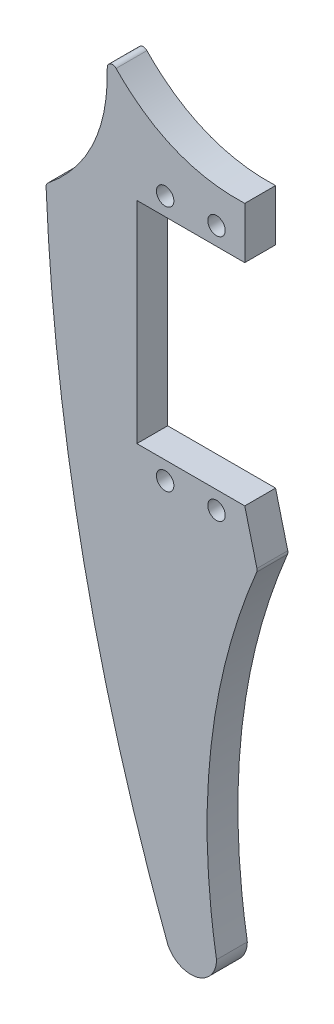
from build123d import *

# Parameters (mm, degrees)
SKETCH1_R           = 1.7
BOSS_EXTRUDE1_DEPTH = 6
FILLET1_R           = 1


with BuildPart() as part:
    # Sketch1 → Boss-Extrude1 (new body)
    # profile 1 of 2: a face of its own
    with BuildSketch(Plane.XY):
        with BuildLine():
            Line((10.5, -20.5), (-10.5, -20.5))
            Line((-10.5, -20.5), (-10.5, 20.5))
            Line((-10.5, 20.5), (10.5, 20.5))
            Line((10.5, 20.5), (10.5, 30.5))
            add(Edge.make_bspline(
                [(10.5, 30.5), (-5.463373434, 29.901564355), (-16.430762864, 42.802630452)],
                knots=[0, 0, 0, 1, 1, 1], degree=2))
            add(Edge.make_bspline(
                [(-16.430762864, 42.802630452), (-14.784114241, 25.00850842), (-28.192589157, 14.474851635)],
                knots=[0, 0, 0, 1, 1, 1], degree=2))
            add(Edge.make_bspline(
                [(-28.192589157, 14.474851635), (-25.736030858, -44.983019262), (-4.860661097, -100.922166241)],
                knots=[0, 0, 0, 0.989904815, 0.989904815, 0.989904815], degree=2))
            ThreePointArc((-4.860661097, -100.922166241), (-1.370198617, -94.941408132), (4.748458048, -98.184066997))
            add(Edge.make_bspline(
                [(12.954080919, -30.194198618), (-0.768915938, -62.557526438), (4.748458048, -98.184066997)],
                knots=[0, 0, 0, 0.978516684, 0.978516684, 0.978516684], degree=2))
            Line((12.954080919, -30.194198618), (10.5, -20.5))
        make_face()
        with Locations((-5, -24)):
            Circle(SKETCH1_R, mode=Mode.SUBTRACT)
        with Locations((5, -24)):
            Circle(SKETCH1_R, mode=Mode.SUBTRACT)
        with Locations((-5, 24)):
            Circle(SKETCH1_R, mode=Mode.SUBTRACT)
        with Locations((5, 24)):
            Circle(SKETCH1_R, mode=Mode.SUBTRACT)
    # profile 2 of 2: a face of its own
    with BuildSketch(Plane.XY):
        with BuildLine():
            add(Edge.make_bspline(
                [(4.748458048, -98.184066997), (4.86959189, -98.96624703), (5, -99.75)],
                knots=[0.978516684, 0.978516684, 0.978516684, 1, 1, 1], degree=2))
            ThreePointArc((4.748458048, -98.184066997), (-1.370198617, -94.941408132), (-4.860661097, -100.922166241))
            add(Edge.make_bspline(
                [(-4.860661097, -100.922166241), (-4.647771209, -101.492641346), (-4.432965727, -102.062750497)],
                knots=[0.989904815, 0.989904815, 0.989904815, 1, 1, 1], degree=2))
            ThreePointArc((-4.432965727, -102.062750497), (1.190624073, -104.606172806), (5, -99.75))
        make_face()
    extrude(amount=BOSS_EXTRUDE1_DEPTH)

    # Fillet1
    fillet1_edges = [part.edges().sort_by_distance(p)[0] for p in [
        (-28.192589157, 14.474851635, 3),
        (-16.430762864, 42.802630452, 3),
        (12.954080919, -30.194198618, 3),
    ]]
    fillet(fillet1_edges, radius=FILLET1_R)


solid = part.part
